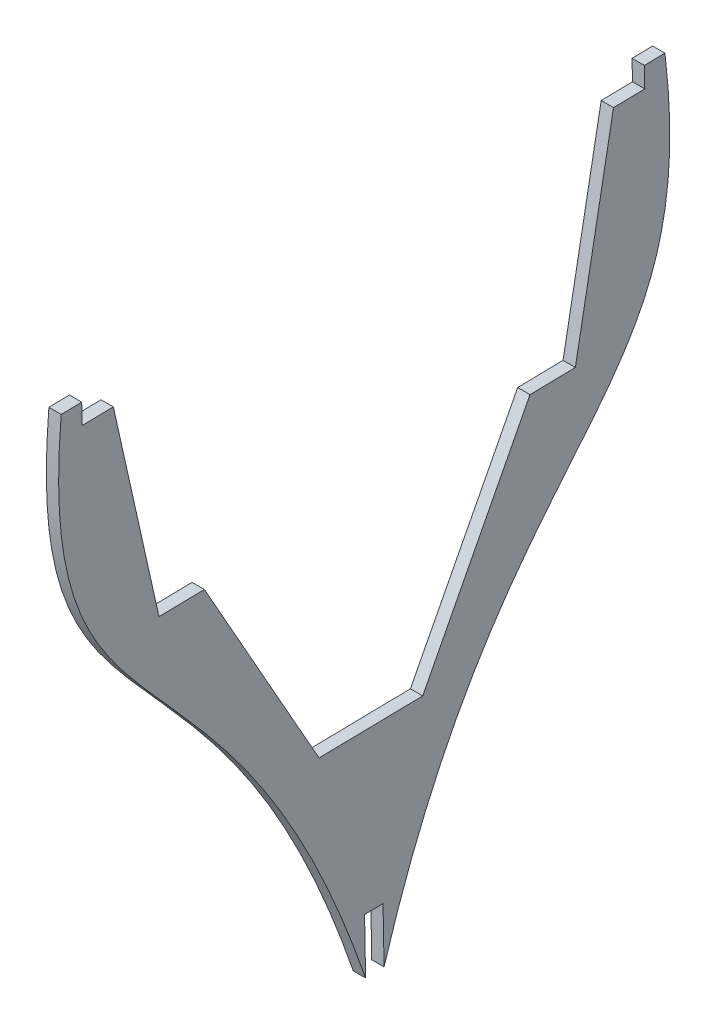
from build123d import *

# Parameters (mm, degrees)
BOSS_EXTRU_3_DEPTH      = 6
ENL_V_MAT_EXTRU_1_DEPTH = 6


with BuildPart() as part:
    # Esquisse2 → Boss.-Extru.3 (new body)
    with BuildSketch(Plane(origin=(0, 0, 0), x_dir=(0, 0, -1), z_dir=(1, 0, 0))):
        with BuildLine():
            Line((-153.58108881, 355.378099815), (-143.58108881, 355.560361684))
            Line((-143.58108881, 355.560361684), (-143.39882694, 345.560361684))
            Line((-143.39882694, 345.560361684), (-128.169304566, 345.837937807))
            Line((-128.169304566, 345.837937807), (-105.94396261, 246.22641273))
            Line((-105.94396261, 246.22641273), (-83.820853526, 246.629632653))
            Line((-83.820853526, 246.629632653), (-27.941981049, 147.631483115))
            Line((-27.941981049, 147.631483115), (22.543691986, 148.551644432))
            Line((22.543691986, 148.551644432), (74.777932377, 249.52028378))
            Line((74.777932377, 249.52028378), (96.901041462, 249.923503702))
            Line((96.901041462, 249.923503702), (115.481751333, 350.27876751))
            Line((115.481751333, 350.27876751), (130.711273707, 350.556343633))
            Line((130.711273707, 350.556343633), (130.529011837, 360.556343633))
            Line((130.529011837, 360.556343633), (140.529011837, 360.738605503))
            add(Edge.make_bspline(
                [(140.529011837, 360.738605503), (159.646581348, 204.687512569), (59.642616495, 244.092023687), (-0.530415896, 29.101857484)],
                knots=[0, 0, 0, 0, 1, 1, 1, 1], degree=3))
            add(Edge.make_bspline(
                [(-153.58108881, 355.378099815), (-166.999417296, 198.734001521), (-68.497782766, 241.75651281), (-0.530415896, 29.101857484)],
                knots=[0, 0, 0, 0, 1, 1, 1, 1], degree=3))
        make_face()
    extrude(amount=BOSS_EXTRU_3_DEPTH)

    # Esquisse3 → Enlèv. mat.-Extru.1 (cut)
    with BuildSketch(Plane(origin=(6, 0, 0), x_dir=(0, 0, -1), z_dir=(1, 0, 0))):
        Polygon((-5.293457494, 43.451909202), (-5.785564543, 70.451909202), (3.214435457, 70.615944885), (3.706542506, 43.615944885), (37.266820682, 4.89282241), (-21.958507577, 2.054547892), align=None)
    extrude(amount=-ENL_V_MAT_EXTRU_1_DEPTH, mode=Mode.SUBTRACT)


solid = part.part
